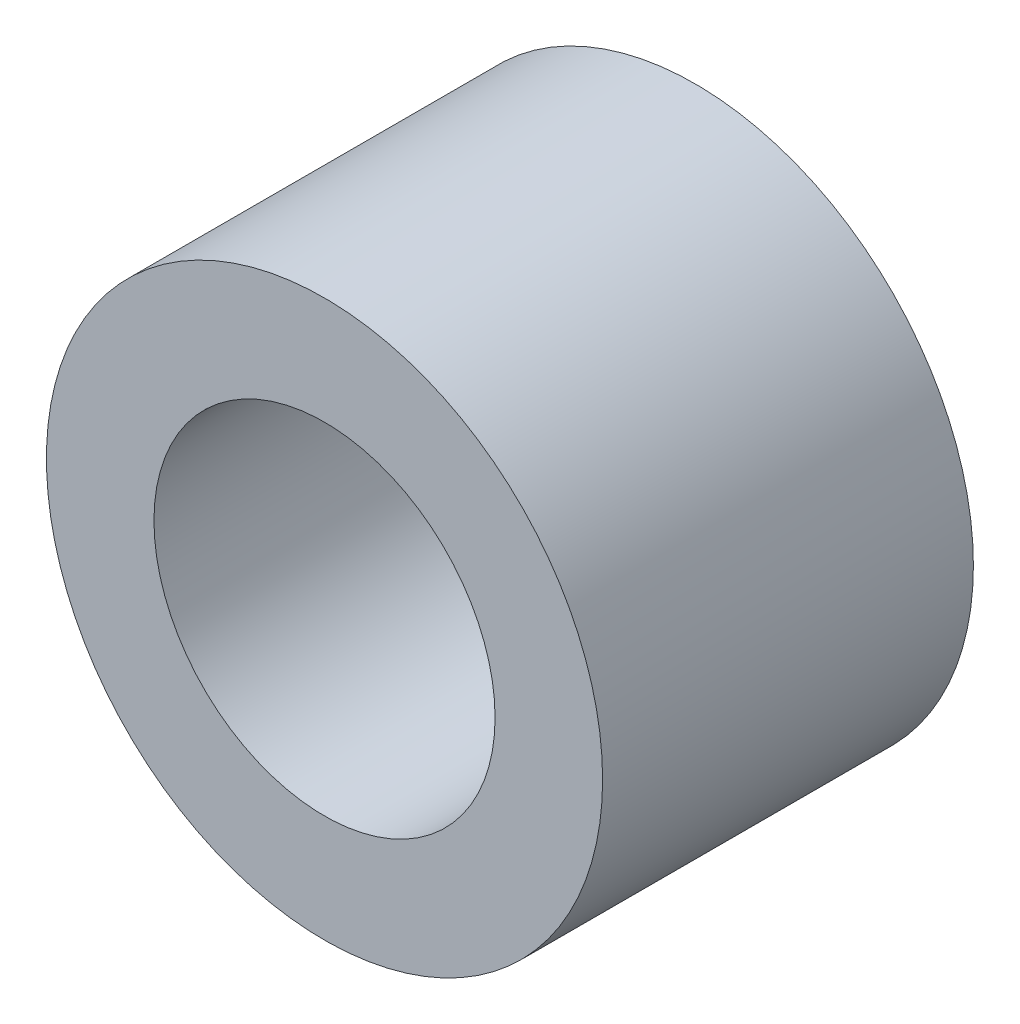
from build123d import *

# Parameters (mm, degrees)
SKETCH1_R      = 2.38125
SKETCH1_R_2    = 1.4605
EXTRUDE1_DEPTH = 1.5875


with BuildPart() as part:
    # Sketch1 → Extrude1 (new, symmetric)
    with BuildSketch(Plane.XY):
        Circle(SKETCH1_R)
        Circle(SKETCH1_R_2, mode=Mode.SUBTRACT)
    extrude(amount=EXTRUDE1_DEPTH, both=True)


solid = part.part
